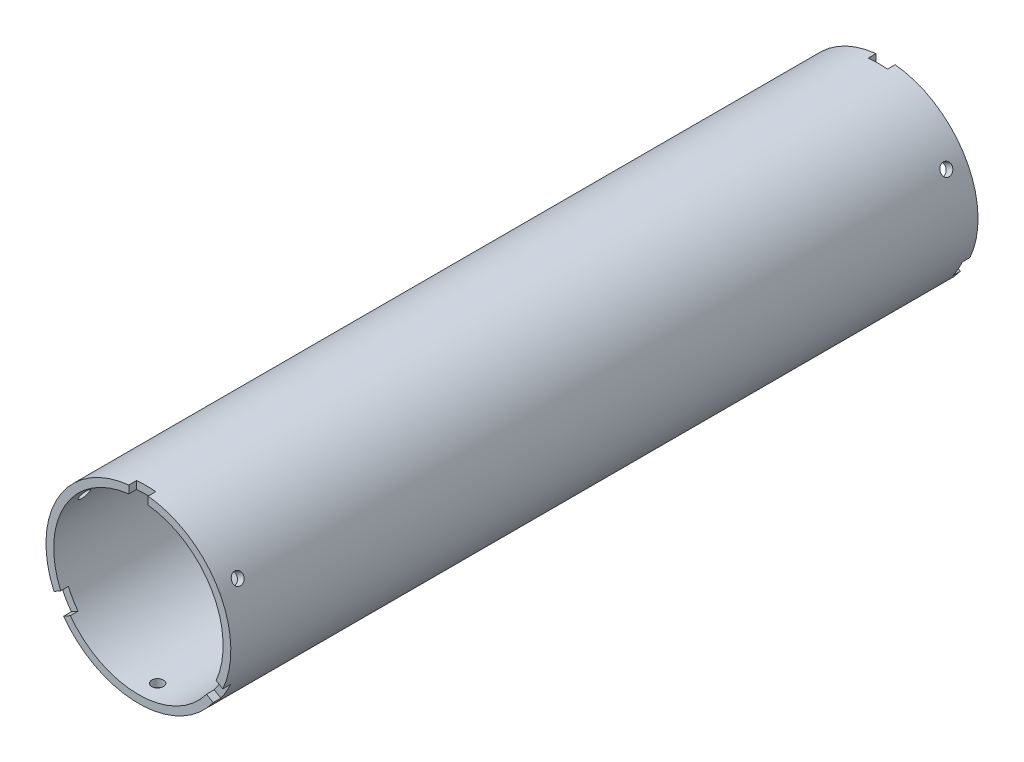
from build123d import *

# Parameters (mm, degrees)
SKETCH_1_R               = 24
SKETCH_1_R_2             = 22
EXTRUDE_1_DEPTH          = 194
SKETCH_2_R               = 1.5
CUT_EXTRUDE_1_DEPTH      = 88
PATTERN_CIRCULAR_1_COUNT = 3
SKETCH_3_W               = 5
SKETCH_3_H               = 11.473941433
CUT_EXTRUDE_2_DEPTH      = 2
PATTERN_CIRCULAR_2_COUNT = 3
SKETCH_4_W               = 5
SKETCH_4_H               = 11.473941433
CUT_EXTRUDE_3_DEPTH      = 2
PATTERN_CIRCULAR_3_COUNT = 3


with BuildPart() as part:
    # Эскиз1 → Бобышка-Вытянуть1 (new body)
    with BuildSketch(Plane.XY):
        with Locations(Location((0, 0, 0), (0, 0, 180))):
            Circle(SKETCH_1_R)
        with Locations(Location((0, 0, 0), (0, 0, 180))):
            Circle(SKETCH_1_R_2, mode=Mode.SUBTRACT)
    extrude(amount=EXTRUDE_1_DEPTH)

    # Эскиз2 → Вырез-Вытянуть1 (cut)
    with BuildSketch(Plane(origin=(0, 0, 0), x_dir=(1, 0, 0), z_dir=(0, 1, 0))):
        with Locations(Location((0, -5, 0), (0, 0, 270))):
            Circle(SKETCH_2_R)
        with Locations(Location((0, -189, 0), (0, 0, 270))):
            Circle(SKETCH_2_R)
    cut_extrude_1 = extrude(amount=-CUT_EXTRUDE_1_DEPTH, mode=Mode.SUBTRACT)

    # Круговой массив1: Вырез-Вытянуть1 ×3 about axis
    pattern_circular_1_axis = Axis((0, 0, 194), (0, 0, -1))
    for i in range(1, PATTERN_CIRCULAR_1_COUNT):
        add(cut_extrude_1.rotate(pattern_circular_1_axis, i * 360 / PATTERN_CIRCULAR_1_COUNT), mode=Mode.SUBTRACT)

    # Эскиз3 → Вырез-Вытянуть2 (cut)
    with BuildSketch(Plane(origin=(0, 0, 0), x_dir=(-1, 0, 0), z_dir=(0, 0, -1))):
        with Locations((0, 22.870937025)):
            Rectangle(SKETCH_3_W, SKETCH_3_H)
    cut_extrude_2 = extrude(amount=-CUT_EXTRUDE_2_DEPTH, mode=Mode.SUBTRACT)

    # Круговой массив2: Вырез-Вытянуть2 ×3 about axis
    pattern_circular_2_axis = Axis((0, 0, 0), (0, 0, 1))
    for i in range(1, PATTERN_CIRCULAR_2_COUNT):
        add(cut_extrude_2.rotate(pattern_circular_2_axis, i * 360 / PATTERN_CIRCULAR_2_COUNT), mode=Mode.SUBTRACT)

    # Эскиз4 → Вырез-Вытянуть3 (cut)
    with BuildSketch(Plane.XY.offset(194)):
        with Locations((0, 22.870937025)):
            Rectangle(SKETCH_4_W, SKETCH_4_H)
    cut_extrude_3 = extrude(amount=-CUT_EXTRUDE_3_DEPTH, mode=Mode.SUBTRACT)

    # Круговой массив3: Вырез-Вытянуть3 ×3 about axis
    pattern_circular_3_axis = Axis((0, 0, 0), (0, 0, 1))
    for i in range(1, PATTERN_CIRCULAR_3_COUNT):
        add(cut_extrude_3.rotate(pattern_circular_3_axis, i * 360 / PATTERN_CIRCULAR_3_COUNT), mode=Mode.SUBTRACT)


solid = part.part
